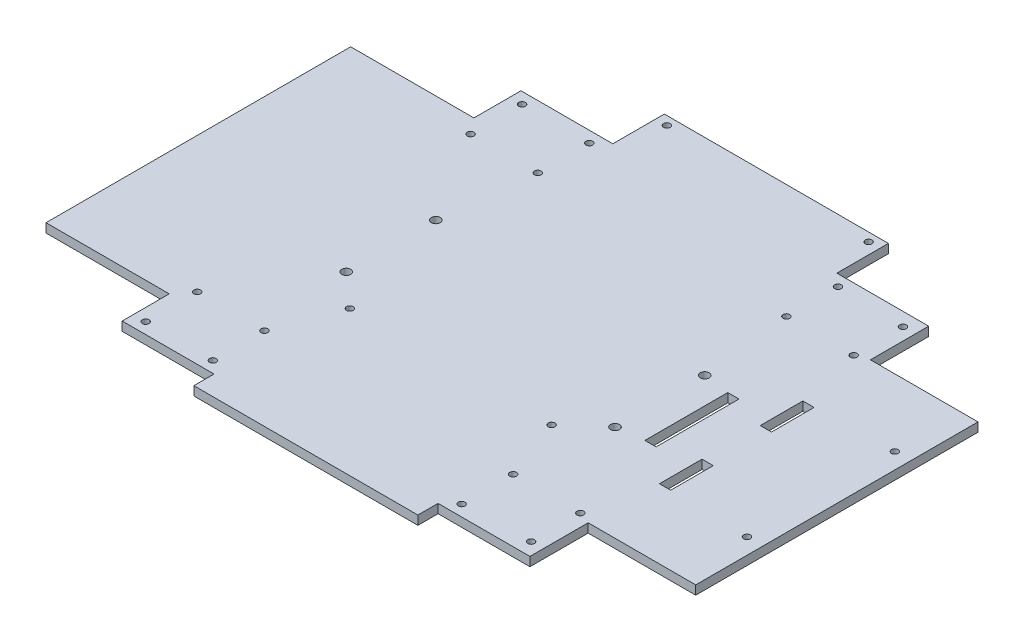
from build123d import *

# Parameters (mm, degrees)
EXTRUDE_630_DEPTH           = 2
CUT_EXTRUDE_1091_DEPTH      = 311.882614503
CUT_EXTRUDE_1091_DEPTH_BACK = 311.882614503
SKETCH_5_R                  = 1.5
CUT_EXTRUDE_1860_DEPTH      = 311.882614503
CUT_EXTRUDE_1860_DEPTH_BACK = 311.882614503
SKETCH_10_R                 = 1.5
CUT_EXTRUDE_2028_DEPTH      = 311.882614503
CUT_EXTRUDE_2028_DEPTH_BACK = 311.882614503
SKETCH_11_R                 = 2
CUT_EXTRUDE_2382_DEPTH      = 311.882614503
CUT_EXTRUDE_2382_DEPTH_BACK = 311.882614503
SKETCH_12_W                 = 5
SKETCH_12_H                 = 19
SKETCH_12_H_2               = 37
CUT_EXTRUDE_2536_DEPTH      = 311.882614503
CUT_EXTRUDE_2536_DEPTH_BACK = 311.882614503
SKETCH_13_R                 = 1.5


with BuildPart() as part:
    # 草图1 → Extrude 630 (new, symmetric)
    with BuildSketch(Plane(origin=(0, 0, 0), x_dir=(1, 0, 0), z_dir=(0, 1, 0))):
        Polygon((290, -63), (290, 63), (242, 63), (242, 89), (201, 89), (201, 112), (101, 112), (101, 89), (60, 89), (60, 68), (5, 68), (5, -68), (60, -68), (60, -89), (101, -89), (101, -98), (201, -98), (201, -89), (242, -89), (242, -63), align=None)
    extrude(amount=EXTRUDE_630_DEPTH, both=True)

    # 草图5 → Cut-Extrude 1091 (cut, two sides: drawn at the far end of the back side and taken through both)
    with BuildSketch(Plane(origin=(0, 0, 0), x_dir=(1, 0, 0), z_dir=(0, 1, 0)).offset(-CUT_EXTRUDE_1091_DEPTH_BACK)):
        with Locations(Location((65.5, 84, 0), (0, 0, 270))):
            Circle(SKETCH_5_R)
        with Locations(Location((95.5, 84, 0), (0, 0, 270))):
            Circle(SKETCH_5_R)
        with Locations(Location((65.5, 61, 0), (0, 0, 270))):
            Circle(SKETCH_5_R)
        with Locations(Location((95.5, 61, 0), (0, 0, 270))):
            Circle(SKETCH_5_R)
        with Locations(Location((206.5, 61, 0), (0, 0, 270))):
            Circle(SKETCH_5_R)
        with Locations(Location((206.5, 84, 0), (0, 0, 270))):
            Circle(SKETCH_5_R)
        with Locations(Location((236.5, 61, 0), (0, 0, 270))):
            Circle(SKETCH_5_R)
        with Locations(Location((236.5, 83, 0), (0, 0, 270))):
            Circle(SKETCH_5_R)
        with Locations(Location((236.5, -61, 0), (0, 0, 90))):
            Circle(SKETCH_5_R)
        with Locations(Location((206.5, -61, 0), (0, 0, 90))):
            Circle(SKETCH_5_R)
        with Locations(Location((236.5, -83, 0), (0, 0, 90))):
            Circle(SKETCH_5_R)
        with Locations(Location((206.5, -84, 0), (0, 0, 90))):
            Circle(SKETCH_5_R)
        with Locations(Location((95.5, -61, 0), (0, 0, 90))):
            Circle(SKETCH_5_R)
        with Locations(Location((95.5, -84, 0), (0, 0, 90))):
            Circle(SKETCH_5_R)
        with Locations(Location((65.5, -61, 0), (0, 0, 90))):
            Circle(SKETCH_5_R)
        with Locations(Location((65.5, -84, 0), (0, 0, 90))):
            Circle(SKETCH_5_R)
    extrude(amount=CUT_EXTRUDE_1091_DEPTH + CUT_EXTRUDE_1091_DEPTH_BACK, mode=Mode.SUBTRACT)

    # 草图10 → Cut-Extrude 1860 (cut, two sides: drawn at the far end of the back side and taken through both)
    with BuildSketch(Plane(origin=(0, 0, 0), x_dir=(1, 0, 0), z_dir=(0, 1, 0)).offset(-CUT_EXTRUDE_1860_DEPTH_BACK)):
        with Locations(Location((106, 108.159987948, 0), (0, 0, 270))):
            Circle(SKETCH_10_R)
        with Locations(Location((196, 108.159987948, 0), (0, 0, 270))):
            Circle(SKETCH_10_R)
        with Locations(Location((106, -33.340012052, 0), (0, 0, 270))):
            Circle(SKETCH_10_R)
        with Locations(Location((196, -33.340012052, 0), (0, 0, 270))):
            Circle(SKETCH_10_R)
    extrude(amount=CUT_EXTRUDE_1860_DEPTH + CUT_EXTRUDE_1860_DEPTH_BACK, mode=Mode.SUBTRACT)

    # 草图11 → Cut-Extrude 2028 (cut, two sides: drawn at the far end of the back side and taken through both)
    with BuildSketch(Plane(origin=(0, 0, 0), x_dir=(1, 0, 0), z_dir=(0, 1, 0)).offset(-CUT_EXTRUDE_2028_DEPTH_BACK)):
        with Locations(Location((91, 20, 0), (0, 0, 270))):
            Circle(SKETCH_11_R)
        with Locations(Location((91, -20, 0), (0, 0, 270))):
            Circle(SKETCH_11_R)
        with Locations(Location((211, 20, 0), (0, 0, 270))):
            Circle(SKETCH_11_R)
        with Locations(Location((211, -20, 0), (0, 0, 270))):
            Circle(SKETCH_11_R)
    extrude(amount=CUT_EXTRUDE_2028_DEPTH + CUT_EXTRUDE_2028_DEPTH_BACK, mode=Mode.SUBTRACT)

    # 草图12 → Cut-Extrude 2382 (cut, two sides: drawn at the far end of the back side and taken through both)
    with BuildSketch(Plane(origin=(0, 0, 0), x_dir=(1, 0, 0), z_dir=(0, 1, 0)).offset(-CUT_EXTRUDE_2382_DEPTH_BACK)):
        with Locations((245.321540625, 22.5)):
            Rectangle(SKETCH_12_W, SKETCH_12_H)
        with Locations((245.321540625, -22.5)):
            Rectangle(SKETCH_12_W, SKETCH_12_H)
        with Locations((225.321540625, 0)):
            Rectangle(SKETCH_12_W, SKETCH_12_H_2)
    extrude(amount=CUT_EXTRUDE_2382_DEPTH + CUT_EXTRUDE_2382_DEPTH_BACK, mode=Mode.SUBTRACT)

    # 草图13 → Cut-Extrude 2536 (cut, two sides: drawn at the far end of the back side and taken through both)
    with BuildSketch(Plane(origin=(0, 0, 0), x_dir=(1, 0, 0), z_dir=(0, 1, 0)).offset(-CUT_EXTRUDE_2536_DEPTH_BACK)):
        with Locations(Location((282.881144326, 33, 0), (0, 0, 270))):
            Circle(SKETCH_13_R)
        with Locations(Location((282.881144326, -33, 0), (0, 0, 270))):
            Circle(SKETCH_13_R)
    extrude(amount=CUT_EXTRUDE_2536_DEPTH + CUT_EXTRUDE_2536_DEPTH_BACK, mode=Mode.SUBTRACT)


solid = part.part
